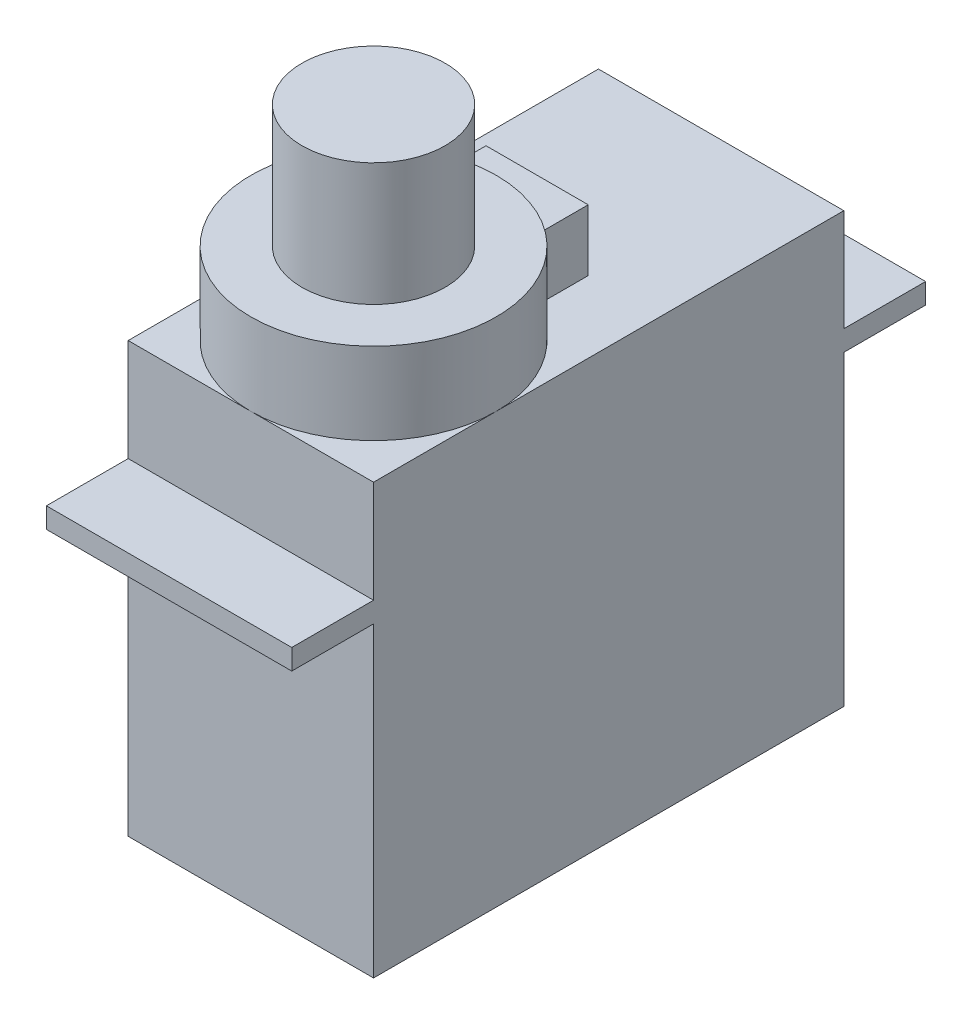
from build123d import *

# Parameters (mm, degrees)
SKETCH1_W           = 12
SKETCH1_H           = 23
BOSS_EXTRUDE1_DEPTH = 21
SKETCH2_W           = 31
SKETCH2_H           = 1
BOSS_EXTRUDE2_DEPTH = 12
SKETCH3_R           = 6
BOSS_EXTRUDE3_DEPTH = 4
SKETCH4_W           = 5
SKETCH4_H           = 8
BOSS_EXTRUDE4_DEPTH = 3
SKETCH5_R           = 3.5
BOSS_EXTRUDE5_DEPTH = 6


with BuildPart() as part:
    # Sketch1 → Boss-Extrude1 (new body)
    with BuildSketch(Plane(origin=(0, 0, 0), x_dir=(1, 0, 0), z_dir=(0, 1, 0))):
        Rectangle(SKETCH1_W, SKETCH1_H)
    extrude(amount=BOSS_EXTRUDE1_DEPTH)

    # Sketch2 → Boss-Extrude2 (add)
    with BuildSketch(Plane(origin=(6, 0, 0), x_dir=(0, 0, -1), z_dir=(1, 0, 0))):
        with Locations((0, 15.5)):
            Rectangle(SKETCH2_W, SKETCH2_H)
    extrude(amount=-BOSS_EXTRUDE2_DEPTH)

    # Sketch3 → Boss-Extrude3 (add)
    with BuildSketch(Plane(origin=(0, 21, 0), x_dir=(1, 0, 0), z_dir=(0, 1, 0))):
        with Locations(Location((0, -5.5, 0), (0, 0, 270))):
            Circle(SKETCH3_R)
    extrude(amount=BOSS_EXTRUDE3_DEPTH)

    # Sketch4 → Boss-Extrude4 (add)
    with BuildSketch(Plane(origin=(0, 21, 0), x_dir=(1, 0, 0), z_dir=(0, 1, 0))):
        with Locations((0, -1.5)):
            Rectangle(SKETCH4_W, SKETCH4_H)
    extrude(amount=BOSS_EXTRUDE4_DEPTH)

    # Sketch5 → Boss-Extrude5 (add)
    with BuildSketch(Plane(origin=(0, 25, 0), x_dir=(1, 0, 0), z_dir=(0, 1, 0))):
        with Locations(Location((0, -5.5, 0), (0, 0, 270))):
            Circle(SKETCH5_R)
    extrude(amount=BOSS_EXTRUDE5_DEPTH)


solid = part.part
